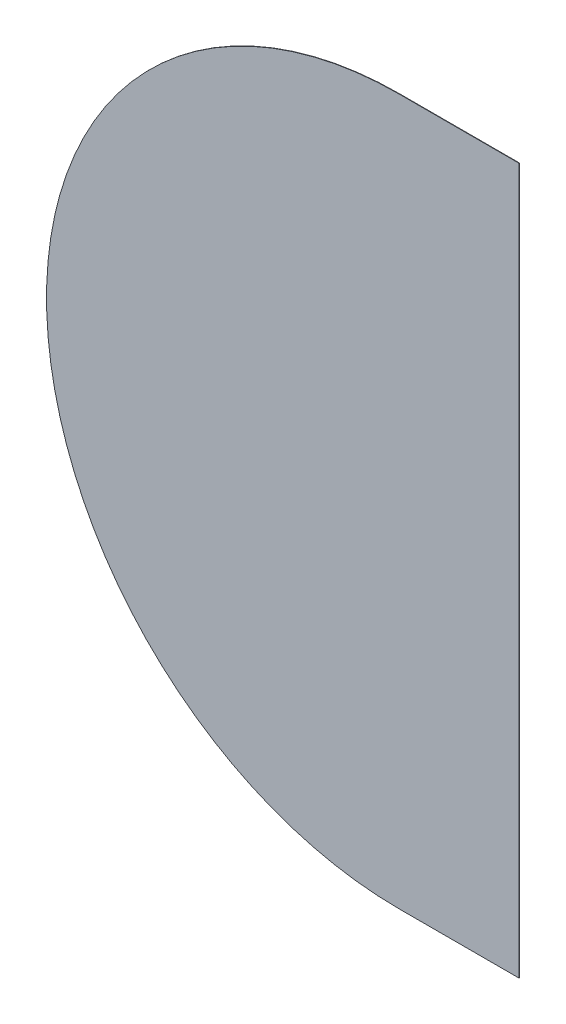
from build123d import *

# Parameters (mm, degrees)
BOSS_EXTRUDE1_DEPTH = 1


with BuildPart() as part:
    # Sketch1 → Boss-Extrude1 (new body)
    with BuildSketch(Plane.XY):
        with BuildLine():
            Line((0, 0), (270, 0))
            Line((270, 0), (270, 1595))
            Line((270, 1595), (0, 1595))
            ThreePointArc((0, 1595), (-797.5, 797.5), (0, 0))
        make_face()
    extrude(amount=BOSS_EXTRUDE1_DEPTH)


solid = part.part
